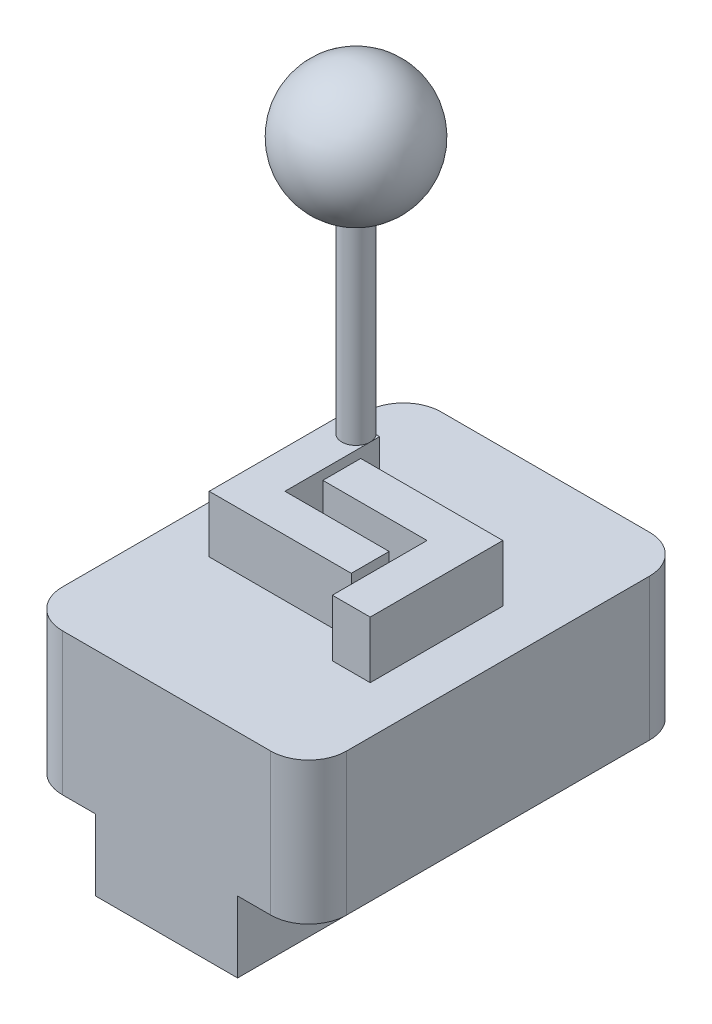
from build123d import *

# Parameters (mm, degrees)
SKETCH_1_W          = 60
SKETCH_1_H          = 45
EXTRUDE_1_DEPTH     = 80
FILLET_1_R          = 8
SKETCH_2_W          = 15
SKETCH_2_H          = 15
CUT_EXTRUDE_1_DEPTH = 110.658560997
SKETCH_3_R          = 2.5
CUT_EXTRUDE_2_DEPTH = 5
EXTRUDE_2_DEPTH     = 12
SKETCH_5_R          = 3
EXTRUDE_4_DEPTH     = 60
SKETCH_7_W          = 9.920530886
SKETCH_7_H          = 15
CUT_EXTRUDE_3_DEPTH = 60


with BuildPart() as part:
    # ｽｹｯﾁ1 → 押し出し1 (new body)
    with BuildSketch(Plane.XY):
        with Locations((30, 22.5)):
            Rectangle(SKETCH_1_W, SKETCH_1_H)
    extrude(amount=EXTRUDE_1_DEPTH)

    # ﾌｨﾚｯﾄ1
    fillet_1_edges = [part.edges().sort_by_distance(p)[0] for p in [
        (60, 22.5, 80),
        (0, 22.5, 80),
        (60, 22.5, 0),
        (0, 22.5, 0),
    ]]
    fillet(fillet_1_edges, radius=FILLET_1_R)

    # ｽｹｯﾁ2 → ｶｯﾄ - 押し出し1 (cut, through all)
    with BuildSketch(Plane.XY.offset(80)):
        with Locations((52.5, 7.5)):
            Rectangle(SKETCH_2_W, SKETCH_2_H)
        with Locations((7.5, 7.5)):
            Rectangle(SKETCH_2_W, SKETCH_2_H)
    extrude(amount=-CUT_EXTRUDE_1_DEPTH, mode=Mode.SUBTRACT)

    # ｽｹｯﾁ3 → ｶｯﾄ - 押し出し2 (cut)
    with BuildSketch(Plane.XZ):
        with Locations(Location((41.136931804, 51.136931804, 0), (0, 0, 270))):
            Circle(SKETCH_3_R)
        with Locations(Location((41.136931804, 28.863068196, 0), (0, 0, 270))):
            Circle(SKETCH_3_R)
        with Locations(Location((18.863068196, 51.136931804, 0), (0, 0, 270))):
            Circle(SKETCH_3_R)
        with Locations(Location((18.863068196, 28.863068196, 0), (0, 0, 270))):
            Circle(SKETCH_3_R)
    extrude(amount=-CUT_EXTRUDE_2_DEPTH, mode=Mode.SUBTRACT)

    # ｽｹｯﾁ4 → 押し出し2 (add)
    with BuildSketch(Plane(origin=(0, 45, 0), x_dir=(-1, 0, 0), z_dir=(0, 1, 0))):
        Polygon((-50, 29), (-20, 29), (-20, 37), (-42, 37), (-42, 57), (-50, 57), align=None)
        Polygon((-10, 23), (-10, 51), (-40, 51), (-40, 43), (-18, 43), (-18, 23), align=None)
    extrude(amount=EXTRUDE_2_DEPTH)


with BuildPart() as body_2:
    # ｽｹｯﾁ5 → 押し出し4 (new body)
    with BuildSketch(Plane(origin=(0, 57, 0), x_dir=(-1, 0, 0), z_dir=(0, 1, 0))):
        with Locations(Location((-30, 40, 0), (0, 0, 270))):
            Circle(SKETCH_5_R)
    extrude(amount=EXTRUDE_4_DEPTH)

    # ｽｹｯﾁ7 → ｶｯﾄ - 押し出し3 (cut)
    with BuildSketch(Plane.XY.offset(51)):
        with Locations((29.960265443, 64.5)):
            Rectangle(SKETCH_7_W, SKETCH_7_H)
    extrude(amount=-CUT_EXTRUDE_3_DEPTH, mode=Mode.SUBTRACT)

    # ｽｹｯﾁ9 → 回転-薄板2 (revolve)
    with BuildSketch(Plane.XY.offset(40), mode=Mode.PRIVATE) as revolve_2_sk:
        with BuildLine():
            ThreePointArc((30.159583172, 113.728184189), (42.584755395, 126.391973903), (30, 138.897189069))
            Line((30, 138.897189069), (30, 139.897189069))
            ThreePointArc((30, 139.897189069), (43.584735295, 126.39831424), (30.17226359, 112.728264589))
            Line((30.17226359, 112.728264589), (30.159583172, 113.728184189))
        make_face()
    revolve(revolve_2_sk.sketch.rotate(Axis((30, 117, 40), (0, 1, 0)), 90), axis=Axis((30, 117, 40), (0, 1, 0)))


solid = Compound([part.part, body_2.part])
